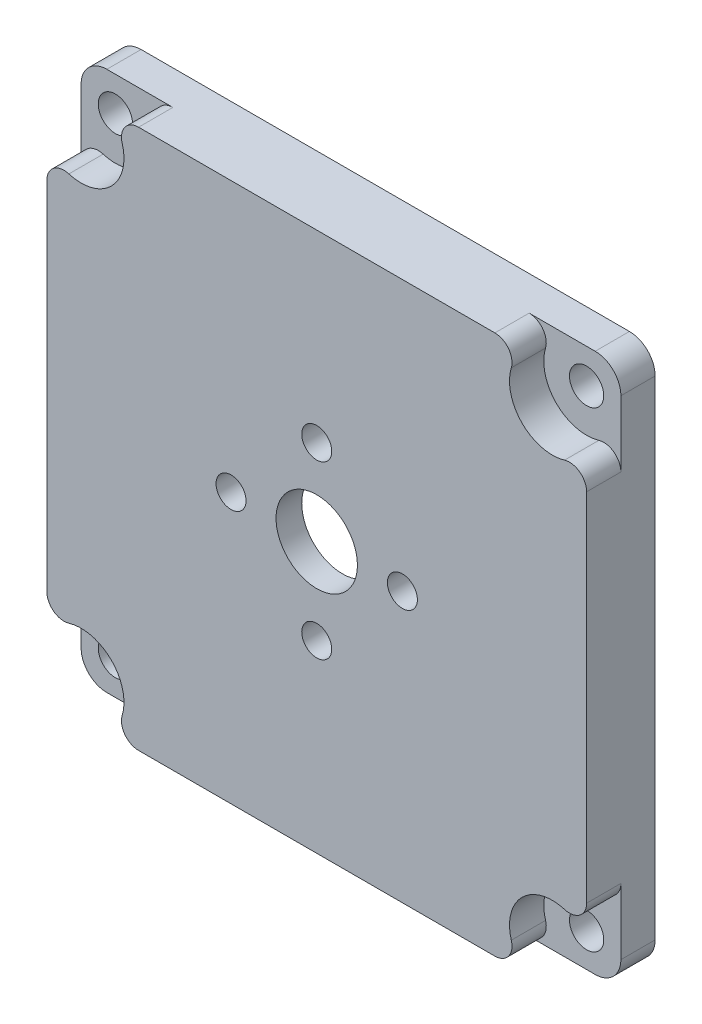
from build123d import *

# Parameters (mm, degrees)
SKETCH1_W           = 63
SKETCH1_H           = 63
BOSS_EXTRUDE1_DEPTH = 8
SKETCH2_W           = 45
SKETCH2_H           = 45
CUT_EXTRUDE1_DEPTH  = 5
SKETCH3_R           = 4.75
CUT_EXTRUDE2_DEPTH  = 5
SKETCH4_R           = 1.75
CUT_EXTRUDE3_DEPTH  = 5
CIRPATTERN1_COUNT   = 4
SKETCH5_R           = 2
CUT_EXTRUDE4_DEPTH  = 15
CIRPATTERN2_COUNT   = 4
FILLET1_R           = 3
SKETCH6_R           = 5
CUT_EXTRUDE5_DEPTH  = 4
CIRPATTERN3_COUNT   = 4
FILLET2_R           = 2
FILLET3_R           = 2


with BuildPart() as part:
    # Sketch1 → Boss-Extrude1 (new body)
    with BuildSketch(Plane.XY):
        Rectangle(SKETCH1_W, SKETCH1_H)
    extrude(amount=BOSS_EXTRUDE1_DEPTH)

    # Sketch2 → Cut-Extrude1 (cut)
    with BuildSketch(Plane(origin=(0, 0, 0), x_dir=(-1, 0, 0), z_dir=(0, 0, -1))):
        Rectangle(SKETCH2_W, SKETCH2_H)
    extrude(amount=-CUT_EXTRUDE1_DEPTH, mode=Mode.SUBTRACT)

    # Sketch3 → Cut-Extrude2 (cut)
    with BuildSketch(Plane.XY.offset(8)):
        Circle(SKETCH3_R)
    extrude(amount=-CUT_EXTRUDE2_DEPTH, mode=Mode.SUBTRACT)

    # Sketch4 → Cut-Extrude3 (cut)
    with BuildSketch(Plane.XY.offset(8)):
        with Locations((0, 10)):
            Circle(SKETCH4_R)
    cut_extrude3 = extrude(amount=-CUT_EXTRUDE3_DEPTH, mode=Mode.SUBTRACT)

    # CirPattern1: Cut-Extrude3 ×4 about axis
    cirpattern1_axis = Axis((0, 0, 0), (0, 0, 1))
    for i in range(1, CIRPATTERN1_COUNT):
        add(cut_extrude3.rotate(cirpattern1_axis, i * 360 / CIRPATTERN1_COUNT), mode=Mode.SUBTRACT)

    # Sketch5 → Cut-Extrude4 (cut)
    with BuildSketch(Plane.XY.offset(8)):
        with Locations((-27.5, 27.5)):
            Circle(SKETCH5_R)
    cut_extrude4 = extrude(amount=-CUT_EXTRUDE4_DEPTH, mode=Mode.SUBTRACT)

    # CirPattern2: Cut-Extrude4 ×4 about axis
    cirpattern2_axis = Axis((0, 0, 0), (0, 0, 1))
    for i in range(1, CIRPATTERN2_COUNT):
        add(cut_extrude4.rotate(cirpattern2_axis, i * 360 / CIRPATTERN2_COUNT), mode=Mode.SUBTRACT)

    # Fillet1
    fillet1_edges = [part.edges().sort_by_distance(p)[0] for p in [
        (-31.5, 31.5, 4),
        (31.5, 31.5, 4),
        (31.5, -31.5, 4),
        (-31.5, -31.5, 4),
    ]]
    fillet(fillet1_edges, radius=FILLET1_R)

    # Sketch6 → Cut-Extrude5 (cut)
    with BuildSketch(Plane.XY.offset(8)):
        with Locations((-27.5, 27.5)):
            Circle(SKETCH6_R)
    cut_extrude5 = extrude(amount=-CUT_EXTRUDE5_DEPTH, mode=Mode.SUBTRACT)

    # CirPattern3: Cut-Extrude5 ×4 about axis
    cirpattern3_axis = Axis((0, 0, 0), (0, 0, 1))
    for i in range(1, CIRPATTERN3_COUNT):
        add(cut_extrude5.rotate(cirpattern3_axis, i * 360 / CIRPATTERN3_COUNT), mode=Mode.SUBTRACT)

    # Fillet2
    fillet2_edges = [part.edges().sort_by_distance(p)[0] for p in [
        (-31.5, 24.5, 6),
        (-24.5, 31.5, 6),
        (31.5, 24.5, 6),
        (24.5, 31.5, 6),
        (24.5, -31.5, 6),
        (31.5, -24.5, 6),
        (-31.5, -24.5, 6),
        (-24.5, -31.5, 6),
    ]]
    fillet(fillet2_edges, radius=FILLET2_R)

    # Fillet3
    fillet3_edges = [part.edges().sort_by_distance(p)[0] for p in [
        (22.5, -22.5, 2.5),
        (22.5, 22.5, 2.5),
        (-22.5, 22.5, 2.5),
        (-22.5, -22.5, 2.5),
    ]]
    fillet(fillet3_edges, radius=FILLET3_R)


solid = part.part
